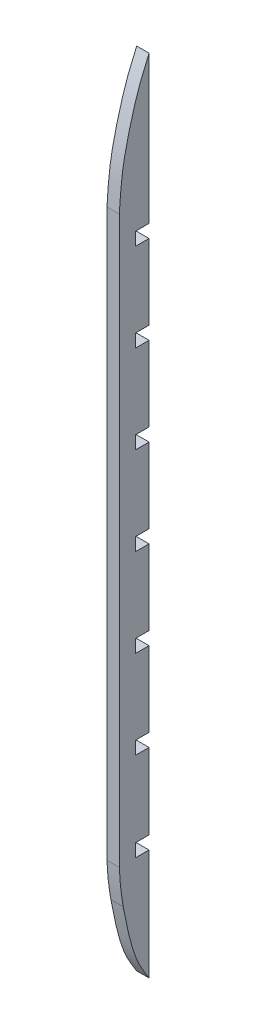
from build123d import *

# Parameters (mm, degrees)
SALIENTE_EXTRUIR1_DEPTH = 2.7


with BuildPart() as part:
    # Croquis1 → Saliente-Extruir1 (new body)
    with BuildSketch(Plane.YZ):
        with BuildLine():
            Line((-55.234115884, -6.578730109), (-38.680874308, -6.578730181))
            Line((-38.680874308, -6.578730181), (-38.680874295, -3.648339402))
            Line((-38.680874295, -3.648339402), (-35.830874295, -3.648339414))
            Line((-35.830874295, -3.648339414), (-35.830874308, -6.578730194))
            Line((-35.830874308, -6.578730194), (-19.420064078, -6.578730266))
            Line((-19.420064078, -6.578730266), (-19.420064066, -3.648339486))
            Line((-19.420064066, -3.648339486), (-16.570064066, -3.648339498))
            Line((-16.570064066, -3.648339498), (-16.570064078, -6.578730278))
            Line((-16.570064078, -6.578730278), (-0.159253849, -6.57873035))
            Line((-0.159253849, -6.57873035), (-0.159253836, -3.64833957))
            Line((-0.159253836, -3.64833957), (2.690746164, -3.648339583))
            Line((2.690746164, -3.648339583), (2.690746151, -6.578730362))
            Line((2.690746151, -6.578730362), (19.101467122, -6.578730434))
            Line((19.101467122, -6.578730434), (19.101467135, -3.648339654))
            Line((19.101467135, -3.648339654), (21.951467135, -3.648339667))
            Line((21.951467135, -3.648339667), (21.951467122, -6.578730446))
            Line((21.951467122, -6.578730446), (38.36236661, -6.578730518))
            Line((38.36236661, -6.578730518), (38.362366623, -3.648339738))
            Line((38.362366623, -3.648339738), (41.212366623, -3.648339751))
            Line((41.212366623, -3.648339751), (41.21236661, -6.57873053))
            Line((41.21236661, -6.57873053), (57.62317684, -6.578730602))
            Line((57.62317684, -6.578730602), (57.623176853, -3.648339823))
            Line((57.623176853, -3.648339823), (60.473176853, -3.648339835))
            Line((60.473176853, -3.648339835), (60.47317684, -6.579394365))
            Line((60.47317684, -6.579394365), (92.691783737, -6.579394365))
            add(Edge.make_bspline(
                [(65.515708358, -0.078730637), (68.197256802, -0.258981281), (73.772414922, -0.633736737), (81.258018047, -2.465410904), (87.672687502, -4.376295676), (91.146213496, -5.900976656), (92.691783737, -6.579394365)],
                knots=[0, 0, 0, 0, 0.286390458, 0.595428587, 0.819983056, 1, 1, 1, 1], degree=3))
            Line((65.515708358, -0.078730637), (-58.084017099, -0.078730097))
            Line((-58.084017099, -0.078730097), (-58.120461042, -0.078730097))
            add(Edge.make_bspline(
                [(-66.004307996, -0.939930258), (-64.387448411, -0.680254728), (-61.772849484, -0.260337396), (-59.129262369, -0.128890612), (-58.120461042, -0.078730097)],
                knots=[0, 0, 0, 0, 0.61839679, 1, 1, 1, 1], degree=3))
            add(Edge.make_bspline(
                [(-82.084508668, -6.41226612), (-80.796356469, -5.618417967), (-78.096313761, -3.954465587), (-72.617339557, -2.219536347), (-68.499900924, -1.422817975), (-66.004307996, -0.939930258)],
                knots=[0, 0, 0, 0, 0.26437177, 0.554138766, 1, 1, 1, 1], degree=3))
            add(Edge.make_bspline(
                [(-82.308216262, -6.578730097), (-82.257659483, -6.539388838), (-82.184342615, -6.482244345), (-82.108242057, -6.428888889), (-82.084508668, -6.41226612)],
                knots=[0, 0, 0, 0, 0.688452323, 1, 1, 1, 1], degree=3))
            Line((-82.308216262, -6.578730097), (-58.084115884, -6.578730097))
            Line((-58.084115884, -6.578730097), (-58.084115884, -3.648339317))
            Line((-58.084115884, -3.648339317), (-55.234115884, -3.648339317))
            Line((-55.234115884, -3.648339317), (-55.234115884, -6.578730109))
        make_face()
    extrude(amount=SALIENTE_EXTRUIR1_DEPTH)


solid = part.part
